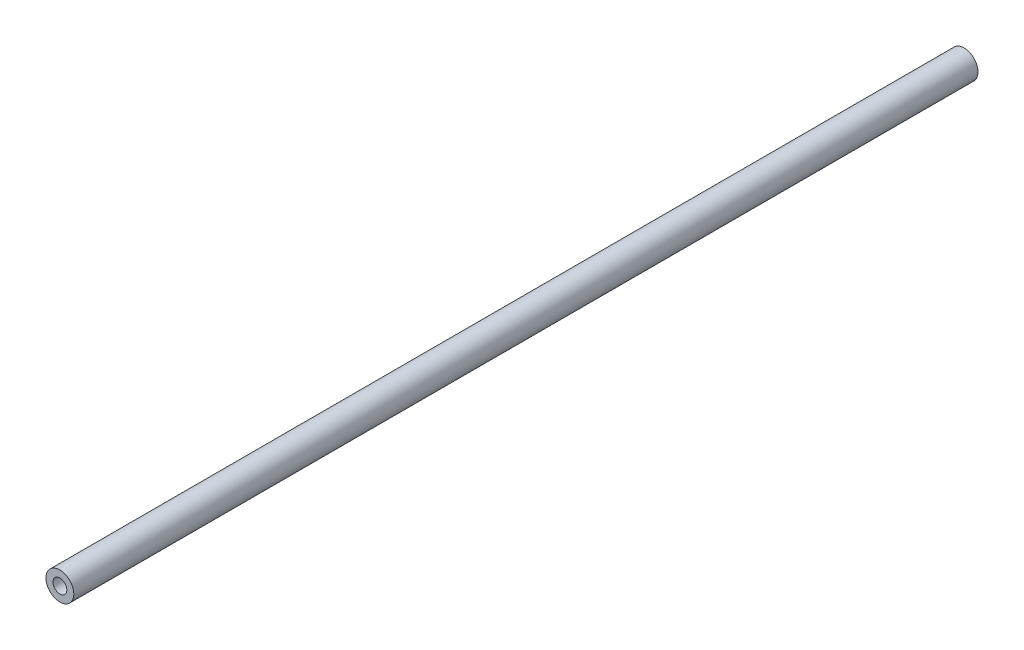
from build123d import *

# Parameters (mm, degrees)
SKETCH_1_R          = 4
EXTRUDE_1_DEPTH     = 260
SKETCH_2_R          = 2
CUT_EXTRUDE_1_DEPTH = 10
CUT_EXTRUDE_START   = -10
SKETCH_3_R          = 2
CUT_EXTRUDE_2_DEPTH = 10


with BuildPart() as part:
    # 草图1 → 凸台-拉伸1 (new body)
    with BuildSketch(Plane.XY):
        Circle(SKETCH_1_R)
    extrude(amount=EXTRUDE_1_DEPTH)

    # 草图2 → 切除-拉伸1 (cut)
    with BuildSketch(Plane.XY.offset(260)):
        Circle(SKETCH_2_R)
    extrude(amount=-CUT_EXTRUDE_1_DEPTH, mode=Mode.SUBTRACT)

    # 草图3 → 切除-拉伸2 (cut)
    with BuildSketch(Plane(origin=(0, 0, 0), x_dir=(-1, 0, 0), z_dir=(0, 0, -1)).offset(CUT_EXTRUDE_START)):
        with Locations(Location((0, 0, 0), (0, 0, 180))):
            Circle(SKETCH_3_R)
    extrude(amount=CUT_EXTRUDE_2_DEPTH, mode=Mode.SUBTRACT)


solid = part.part
